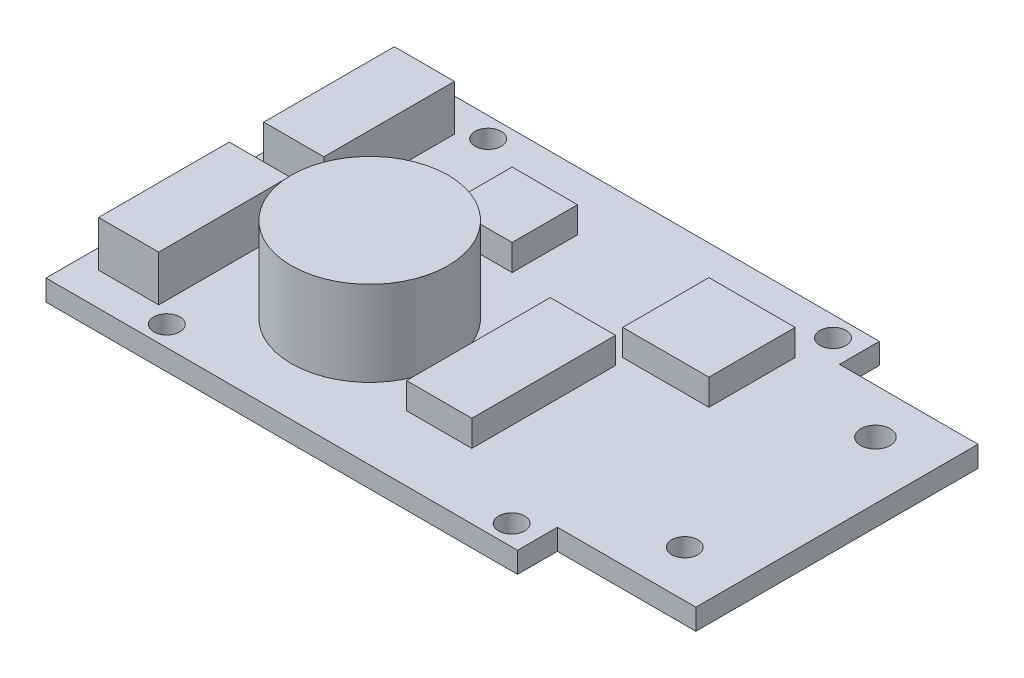
from build123d import *

# Parameters (mm, degrees)
CROQUIS1_R              = 1
SALIENTE_EXTRUIR1_DEPTH = 1.6
CROQUIS2_R              = 1
CORTAR_EXTRUIR1_DEPTH   = 10
CROQUIS3_R              = 6
CROQUIS3_W              = 4.6
CROQUIS3_H              = 10
CROQUIS3_W_2            = 6.6
CROQUIS3_H_2            = 6.6
CROQUIS3_W_3            = 5
CROQUIS3_H_3            = 11
CROQUIS3_H_4            = 5
SALIENTE_EXTRUIR2_DEPTH = 2
CROQUIS4_R              = 6
SALIENTE_EXTRUIR3_DEPTH = 4.5
CROQUIS5_W              = 4.6
CROQUIS5_H              = 10
SALIENTE_EXTRUIR4_DEPTH = 1.5
CROQUIS7_R              = 1.122052982
SALIENTE_EXTRUIR5_DEPTH = 1.6
CROQUIS9_R              = 1.125
CORTAR_EXTRUIR2_DEPTH   = 33.479147156


with BuildPart() as part:
    # Croquis1 → Saliente-Extruir1 (new body)
    with BuildSketch(Plane(origin=(0, 0, 0), x_dir=(1, 0, 0), z_dir=(0, 1, 0))):
        Polygon((-18.05, 13.85), (18.05, 13.85), (18.05, 10.8), (28.65, 10.8), (28.65, -10.8), (18.05, -10.8), (18.05, -13.85), (-18.05, -13.85), align=None)
        with Locations(Location((-10.35, -12.3, 0), (0, 0, 270))):
            Circle(CROQUIS1_R, mode=Mode.SUBTRACT)
        with Locations(Location((16.05, -12.3, 0), (0, 0, 270))):
            Circle(CROQUIS1_R, mode=Mode.SUBTRACT)
        with Locations(Location((16.05, 12.3, 0), (0, 0, 270))):
            Circle(CROQUIS1_R, mode=Mode.SUBTRACT)
        with Locations(Location((-10.35, 12.3, 0), (0, 0, 270))):
            Circle(CROQUIS1_R, mode=Mode.SUBTRACT)
    extrude(amount=SALIENTE_EXTRUIR1_DEPTH)

    # Croquis2 → Cortar-Extruir1 (cut)
    with BuildSketch(Plane(origin=(0, 1.6, 0), x_dir=(1, 0, 0), z_dir=(0, 1, 0))):
        with Locations(Location((24.25, 7.25, 0), (0, 0, 270))):
            Circle(CROQUIS2_R)
        with Locations(Location((24.25, -7.25, 0), (0, 0, 270))):
            Circle(CROQUIS2_R)
    extrude(amount=-CORTAR_EXTRUIR1_DEPTH, mode=Mode.SUBTRACT)

    # Croquis3 → Saliente-Extruir2 (add)
    with BuildSketch(Plane(origin=(0, 1.6, 0), x_dir=(1, 0, 0), z_dir=(0, 1, 0))):
        with Locations(Location((-2.979600995, -4.139800498, 0), (0, 0, 270))):
            Circle(CROQUIS3_R)
        with Locations((-14.25, 6.32)):
            Rectangle(CROQUIS3_W, CROQUIS3_H)
        with Locations((-14.25, -6.32)):
            Rectangle(CROQUIS3_W, CROQUIS3_H)
        with Locations((12.6, 6.25)):
            Rectangle(CROQUIS3_W_2, CROQUIS3_H_2)
        with Locations((7.05, -3.35)):
            Rectangle(CROQUIS3_W_3, CROQUIS3_H_3)
        with Locations((-3.063985121, 6.85)):
            Rectangle(CROQUIS3_W_3, CROQUIS3_H_4)
    extrude(amount=SALIENTE_EXTRUIR2_DEPTH)

    # Croquis4 → Saliente-Extruir3 (add)
    with BuildSketch(Plane(origin=(0, 3.6, 0), x_dir=(1, 0, 0), z_dir=(0, 1, 0))):
        with Locations(Location((-2.979600995, -4.139800498, 0), (0, 0, 270))):
            Circle(CROQUIS4_R)
    extrude(amount=SALIENTE_EXTRUIR3_DEPTH)

    # Croquis5 → Saliente-Extruir4 (add)
    with BuildSketch(Plane(origin=(0, 3.6, 0), x_dir=(1, 0, 0), z_dir=(0, 1, 0))):
        with Locations((-14.25, 6.32)):
            Rectangle(CROQUIS5_W, CROQUIS5_H)
        with Locations((-14.25, -6.32)):
            Rectangle(CROQUIS5_W, CROQUIS5_H)
    extrude(amount=SALIENTE_EXTRUIR4_DEPTH)

    # Croquis7 → Saliente-Extruir5 (add)
    with BuildSketch(Plane.XZ):
        with Locations((24.25, -7.25)):
            Circle(CROQUIS7_R)
    extrude(amount=-SALIENTE_EXTRUIR5_DEPTH)

    # Croquis9 → Cortar-Extruir2 (cut, through all)
    with BuildSketch(Plane(origin=(0, 1.6, 0), x_dir=(1, 0, 0), z_dir=(0, 1, 0))):
        with Locations(Location((24.25, 7.35, 0), (0, 0, 270))):
            Circle(CROQUIS9_R)
    extrude(amount=-CORTAR_EXTRUIR2_DEPTH, mode=Mode.SUBTRACT)


solid = part.part
